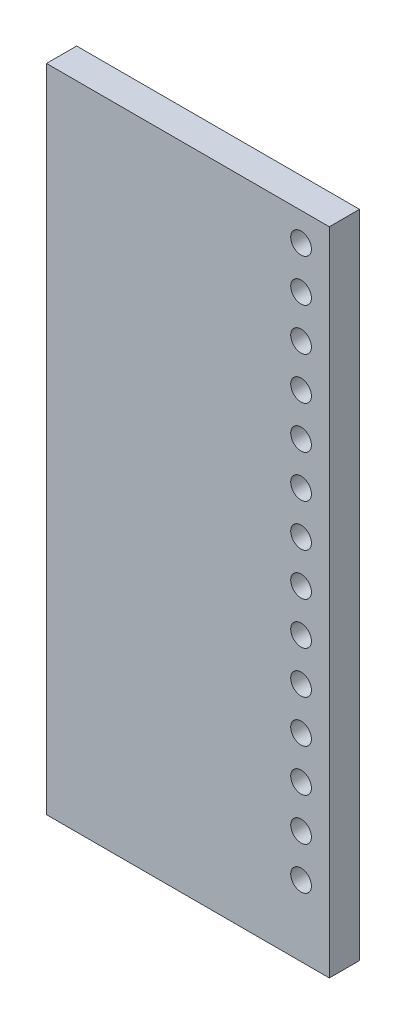
from build123d import *

# Parameters (mm, degrees)
SKETCH1_W                 = 150
SKETCH1_H                 = 345
BOSS_EXTRUDE1_DEPTH       = 16
SKETCH2_R                 = 5.5
CUT_EXTRUDE4_DEPTH        = 354.420429517
LPATTERN1_COUNT           = 14
LPATTERN1_PITCH           = 22.5
F_8_36_TAPPED_HOLE1_D     = 3.4544
F_8_36_TAPPED_HOLE1_DEPTH = 25
F_8_36_TAPPED_HOLE1_TIP   = 1.037806461


with BuildPart() as part:
    # Sketch1 → Boss-Extrude1 (new body)
    with BuildSketch(Plane.XY):
        with Locations((0, 172.5)):
            Rectangle(SKETCH1_W, SKETCH1_H)
    extrude(amount=BOSS_EXTRUDE1_DEPTH)

    # Sketch2 → Cut-Extrude4 (cut, through all)
    with BuildSketch(Plane.XY.offset(16)):
        with Locations((60, 37.5)):
            Circle(SKETCH2_R)
    cut_extrude4 = extrude(amount=-CUT_EXTRUDE4_DEPTH, mode=Mode.SUBTRACT)

    # LPattern1: Cut-Extrude4 ×14
    with Locations(*[(0, i * LPATTERN1_PITCH, 0) for i in range(1, LPATTERN1_COUNT)]):
        add(cut_extrude4, mode=Mode.SUBTRACT)

    # #8-36 Tapped Hole1
    with Locations(Plane(origin=(0, 0, 0), x_dir=(-1, 0, 0), z_dir=(0, -1, 0))):
        with Locations((-60, -8), (0, -8), (60, -8)):
            Hole(F_8_36_TAPPED_HOLE1_D / 2, depth=F_8_36_TAPPED_HOLE1_DEPTH)
            with Locations((0, 0, -(F_8_36_TAPPED_HOLE1_DEPTH + F_8_36_TAPPED_HOLE1_TIP / 2))):  # 118° drill point
                Cone(0, F_8_36_TAPPED_HOLE1_D / 2, F_8_36_TAPPED_HOLE1_TIP, mode=Mode.SUBTRACT)


solid = part.part
